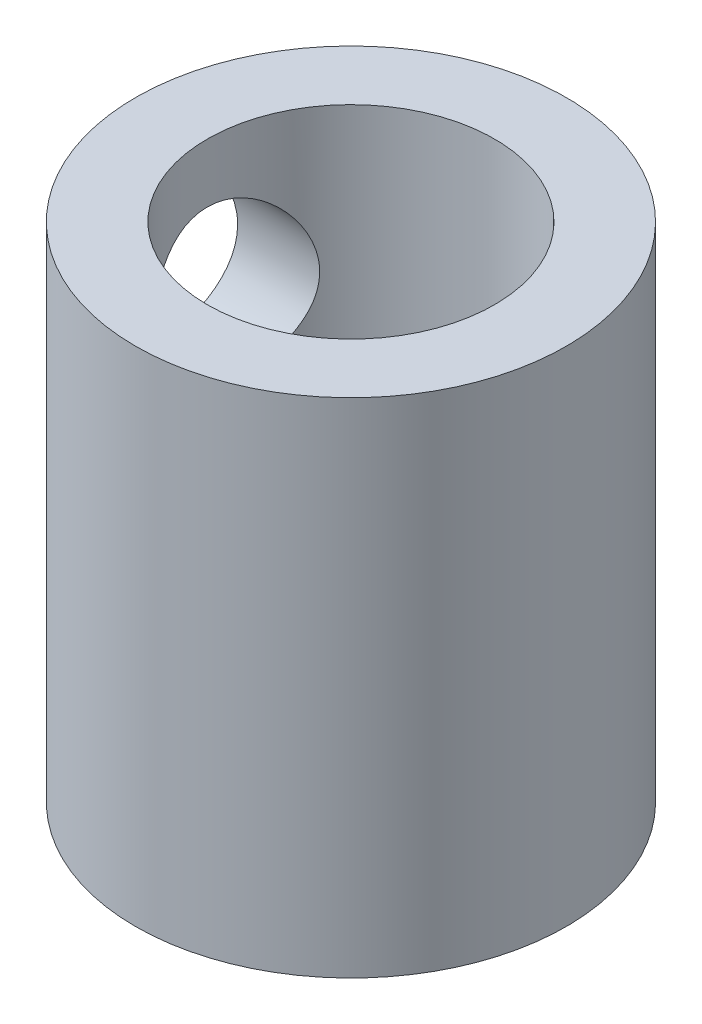
from build123d import *

# Parameters (mm, degrees)
SKETCH1_R               = 15
SKETCH1_R_2             = 10
BOSS_EXTRUDE1_DEPTH     = 35
CUT_EXTRUDE1_REACH      = 42.927
CUT_EXTRUDE1_END_RADIUS = 15
SKETCH3_R               = 5.9


with BuildPart() as part:
    # Sketch1 → Boss-Extrude1 (new body)
    with BuildSketch(Plane(origin=(0, 0, 0), x_dir=(1, 0, 0), z_dir=(0, 1, 0))):
        with Locations(Location((0, 0, 0), (0, 0, 270))):
            Circle(SKETCH1_R)
        with Locations(Location((0, 0, 0), (0, 0, 270))):
            Circle(SKETCH1_R_2, mode=Mode.SUBTRACT)
    extrude(amount=BOSS_EXTRUDE1_DEPTH)

    # Cut-Extrude1: up to this cylinder (the profile starts inside it)
    cut_extrude1_end = Plane(origin=(0, 25, 0), z_dir=(0, -1, 0)) * Cylinder(CUT_EXTRUDE1_END_RADIUS, 116.854, mode=Mode.PRIVATE)
    # Sketch3 → Cut-Extrude1 (cut, up to the surface)
    with BuildSketch(Plane(origin=(0, 0, 0), x_dir=(0, 0, -1), z_dir=(1, 0, 0)), mode=Mode.PRIVATE) as cut_extrude1_sk1:
        with Locations((0, 25)):
            Circle(SKETCH3_R)
    cut_extrude1_tool1 = extrude(cut_extrude1_sk1.sketch, amount=-CUT_EXTRUDE1_REACH, mode=Mode.PRIVATE) & cut_extrude1_end
    add(cut_extrude1_tool1.solids().sort_by_distance((0, 25, 0))[0], mode=Mode.SUBTRACT)


solid = part.part
